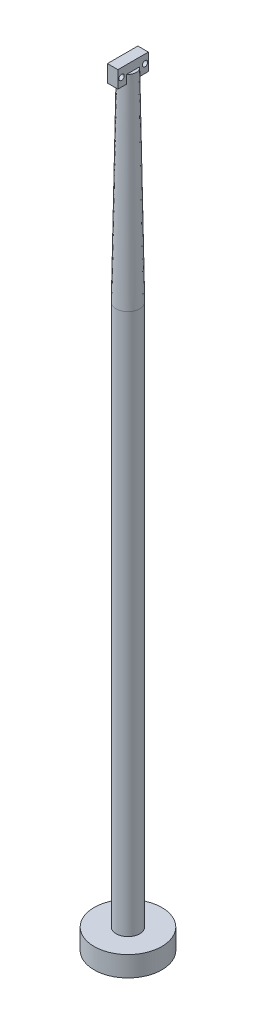
from build123d import *

# Parameters (mm, degrees)
CROQUIS1_R                   = 500
SALIENTE_EXTRUIR1_DEPTH      = 300
CROQUIS2_R                   = 175
SALIENTE_EXTRUIR3_DEPTH      = 8000
CROQUIS4_R                   = 175
SALIENTE_EXTRUIR5_DEPTH      = 3000
SALIENTE_EXTRUIR5_TAPER      = 1
SALIENTE_EXTRUIR6_DEPTH      = 79
SALIENTE_EXTRUIR6_DEPTH_BACK = 76
CROQUIS6_W                   = 450
CROQUIS6_H                   = 250
CROQUIS6_R                   = 40


with BuildPart() as part:
    # Croquis1 → Saliente-Extruir1 (new body)
    with BuildSketch(Plane(origin=(0, 0, 0), x_dir=(1, 0, 0), z_dir=(0, 1, 0))):
        with Locations(Location((0, 0, 0), (0, 0, 270))):
            Circle(CROQUIS1_R)
    extrude(amount=SALIENTE_EXTRUIR1_DEPTH)

    # Croquis2 → Saliente-Extruir3 (add)
    with BuildSketch(Plane(origin=(0, 300, 0), x_dir=(1, 0, 0), z_dir=(0, 1, 0))):
        with Locations(Location((0, 0, 0), (0, 0, 270))):
            Circle(CROQUIS2_R)
    extrude(amount=SALIENTE_EXTRUIR3_DEPTH)

    # Croquis4 → Saliente-Extruir5 (add)
    with BuildSketch(Plane(origin=(0, 8300, 0), x_dir=(1, 0, 0), z_dir=(0, 1, 0))):
        with Locations(Location((0, 0, 0), (0, 0, 270))):
            Circle(CROQUIS4_R)
    extrude(amount=SALIENTE_EXTRUIR5_DEPTH, taper=SALIENTE_EXTRUIR5_TAPER)

    # Croquis6 → Saliente-Extruir6 (add, two sides: drawn at the far end of the back side and taken through both)
    with BuildSketch(Plane.ZY.offset(-SALIENTE_EXTRUIR6_DEPTH_BACK)):
        with Locations((0, 11300)):
            Rectangle(CROQUIS6_W, CROQUIS6_H)
        with Locations((-176.005281437, 11300)):
            Circle(CROQUIS6_R, mode=Mode.SUBTRACT)
        with Locations((171.37286268, 11300)):
            Circle(CROQUIS6_R, mode=Mode.SUBTRACT)
    extrude(amount=SALIENTE_EXTRUIR6_DEPTH + SALIENTE_EXTRUIR6_DEPTH_BACK)


solid = part.part
